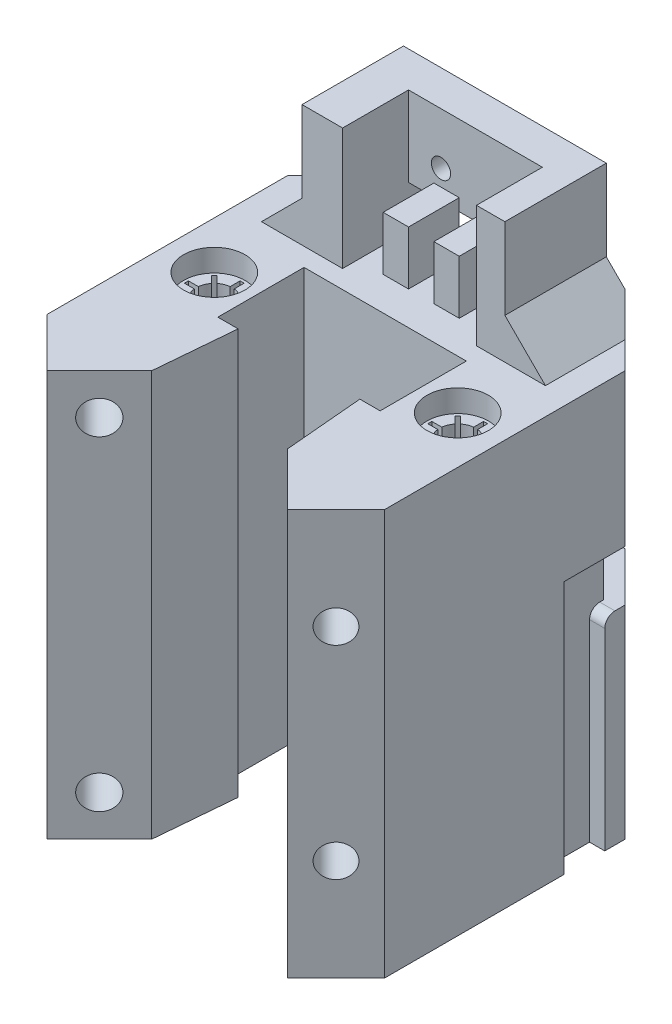
from build123d import *

# Parameters (mm, degrees)
EXTRUDE_1_DEPTH          = 40
SKETCH_2_R               = 1.7
CUT_EXTRUDE_1_DEPTH      = 47.415999397
CUT_EXTRUDE_2_DEPTH      = 47.415999397
EXTRUDE_2_DEPTH          = 12
SKETCH_5_W               = 12
SKETCH_5_H               = 8.5
CUT_EXTRUDE_3_DEPTH      = 47.415999397
CUT_EXTRUDE_4_DEPTH      = 12
SKETCH_7_W               = 2.5
SKETCH_7_H               = 5
EXTRUDE_3_DEPTH          = 5.3
SKETCH_8_W               = 2.5
SKETCH_8_H               = 5
EXTRUDE_4_DEPTH          = 5.2
SKETCH_10_W              = 16
SKETCH_10_H              = 8.5
CUT_EXTRUDE_5_DEPTH      = 47.415999397
SKETCH_11_W              = 7.5
SKETCH_11_H              = 4.1
CUT_EXTRUDE_6_DEPTH      = 11
SKETCH_15_W              = 7.5
SKETCH_15_H              = 5
CUT_EXTRUDE_10_DEPTH     = 10
SKETCH_12_W              = 7.5
SKETCH_12_H              = 1.5
CUT_EXTRUDE_7_DEPTH      = 28
CUT_EXTRUDE_START        = -20
CUT_EXTRUDE_8_DEPTH      = 5
FILLET_2_R               = 2
SKETCH_16_R              = 3.025
CUT_EXTRUDE_11_DEPTH     = 2.2
CUT_EXTRUDE_13_DEPTH     = 2.8
SKETCH_21_R              = 1.6
CUT_EXTRUDE_14_DEPTH     = 5
MIRROR_3_COPY_1_SKETCH_R = 1.6
MIRROR_3_COPY_1_DEPTH    = 5
SKETCH_17_W              = 1.5
SKETCH_17_H              = 4
CUT_EXTRUDE_12_DEPTH     = 40.729648878
FILLET_3_R               = 1
CHAMFER_2_SIZE           = 4
SKETCH_22_R              = 0.95
CUT_EXTRUDE_15_DEPTH     = 63.20339621
SKETCH_23_R              = 0.95
CUT_EXTRUDE_16_DEPTH     = 60.364235866
SKETCH_25_R              = 1.65
CUT_EXTRUDE_17_DEPTH     = 5


with BuildPart() as part:
    # 草图1 → 凸台-拉伸1 (new body)
    with BuildSketch(Plane(origin=(0, 0, 0), x_dir=(1, 0, 0), z_dir=(0, 1, 0))):
        Polygon((11.846403282, 16.65), (-11.846403282, 16.65), (-16.65, 11.846403282), (-16.65, -11.846403282), (-11.846403282, -16.65), (11.846403282, -16.65), (16.65, -11.846403282), (16.65, 11.846403282), align=None)
    extrude(amount=EXTRUDE_1_DEPTH)

    # 草图2 → 切除-拉伸1 (cut, through all)
    with BuildSketch(Plane(origin=(0, 40, 0), x_dir=(1, 0, 0), z_dir=(0, 1, 0))):
        with Locations(Location((12, 0, 0), (0, 0, 270))):
            Circle(SKETCH_2_R)
        with Locations(Location((-12, 0, 0), (0, 0, 90))):
            Circle(SKETCH_2_R)
    extrude(amount=-CUT_EXTRUDE_1_DEPTH, mode=Mode.SUBTRACT)

    # 草图3 → 切除-拉伸2 (cut, through all)
    with BuildSketch(Plane(origin=(0, 40, 0), x_dir=(1, 0, 0), z_dir=(0, 1, 0))):
        Polygon((-6, -3.65), (6, -3.65), (6.685863935, -11.489460654), (11.846403282, -16.65), (-11.846403282, -16.65), (-6.685863935, -11.489460654), align=None)
    extrude(amount=-CUT_EXTRUDE_2_DEPTH, mode=Mode.SUBTRACT)

    # 草图4 → 凸台-拉伸2 (add)
    with BuildSketch(Plane(origin=(0, 40, 0), x_dir=(1, 0, 0), z_dir=(0, 1, 0))):
        Polygon((-10, 16.65), (-10, 6.65), (-6, 6.65), (-6, 13.15), (7.2, 13.15), (7.2, 6.65), (10, 6.65), (10, 16.65), align=None)
    extrude(amount=EXTRUDE_2_DEPTH)

    # 草图5 → 切除-拉伸3 (cut, through all)
    with BuildSketch(Plane(origin=(0, 40, 0), x_dir=(1, 0, 0), z_dir=(0, 1, 0))):
        with Locations((0, 0.6)):
            Rectangle(SKETCH_5_W, SKETCH_5_H)
    extrude(amount=-CUT_EXTRUDE_3_DEPTH, mode=Mode.SUBTRACT)

    # 草图6 → 切除-拉伸4 (cut)
    with BuildSketch(Plane.XZ):
        Polygon((-6, -6.65), (-6, -13.15), (-6, -16.65), (7.2, -16.65), (7.2, -13.15), (7.2, -6.65), align=None)
    extrude(amount=-CUT_EXTRUDE_4_DEPTH, mode=Mode.SUBTRACT)

    # 草图7 → 凸台-拉伸3 (add)
    with BuildSketch(Plane(origin=(0, 40, 0), x_dir=(1, 0, 0), z_dir=(0, 1, 0))):
        with Locations((2.75, 10.65)):
            Rectangle(SKETCH_7_W, SKETCH_7_H)
        with Locations((-2.25, 10.65)):
            Rectangle(SKETCH_7_W, SKETCH_7_H)
    extrude(amount=EXTRUDE_3_DEPTH)

    # 草图8 → 凸台-拉伸4 (add)
    with BuildSketch(Plane.XZ.offset(-12)):
        with Locations((-2.25, -9.15)):
            Rectangle(SKETCH_8_W, SKETCH_8_H)
        with Locations((2.75, -9.15)):
            Rectangle(SKETCH_8_W, SKETCH_8_H)
    extrude(amount=EXTRUDE_4_DEPTH)

    # 草图10 → 切除-拉伸5 (cut, through all)
    with BuildSketch(Plane(origin=(0, 40, 0), x_dir=(1, 0, 0), z_dir=(0, 1, 0))):
        with Locations((0, 0.6)):
            Rectangle(SKETCH_10_W, SKETCH_10_H)
    extrude(amount=-CUT_EXTRUDE_5_DEPTH, mode=Mode.SUBTRACT)

    # 草图11 → 切除-拉伸6 (cut)
    with BuildSketch(Plane.XY.offset(-13.15)):
        with Locations((-2.25, 42.05)):
            Rectangle(SKETCH_11_W, SKETCH_11_H)
    extrude(amount=-CUT_EXTRUDE_6_DEPTH, mode=Mode.SUBTRACT)

    # 草图15 → 切除-拉伸10 (cut)
    with BuildSketch(Plane(origin=(0, 0, -16.65), x_dir=(-1, 0, 0), z_dir=(0, 0, -1))):
        with Locations((2.25, 14.5)):
            Rectangle(SKETCH_15_W, SKETCH_15_H)
    extrude(amount=-CUT_EXTRUDE_10_DEPTH, mode=Mode.SUBTRACT)

    # 草图12 → 切除-拉伸7 (cut)
    with BuildSketch(Plane(origin=(0, 40, 0), x_dir=(1, 0, 0), z_dir=(0, 1, 0))):
        with Locations((-2.25, 15.9)):
            Rectangle(SKETCH_12_W, SKETCH_12_H)
    extrude(amount=-CUT_EXTRUDE_7_DEPTH, mode=Mode.SUBTRACT)

    # 草图13 → 切除-拉伸8 (cut)
    with BuildSketch(Plane.XZ.offset(CUT_EXTRUDE_START)):
        Polygon((11.846403282, -16.65), (1.5, -16.65), (1.5, -15.15), (11.225082938, -15.15), (15.15, -11.225082938), (15.15, -5.846403282), (16.65, -5.846403282), (16.65, -11.846403282), align=None)
    extrude(amount=-CUT_EXTRUDE_8_DEPTH, mode=Mode.SUBTRACT)

    # 圆角2
    fillet_2_edges = [part.edges().sort_by_distance(p)[0] for p in [
        (-2.25, 17, -15.15),
    ]]
    fillet(fillet_2_edges, radius=FILLET_2_R)

    # 草图16 → 切除-拉伸11 (cut)
    with BuildSketch(Plane(origin=(0, 40, 0), x_dir=(1, 0, 0), z_dir=(0, 1, 0))):
        with Locations(Location((12, 0, 0), (0, 0, 270))):
            Circle(SKETCH_16_R)
        with Locations(Location((-12, 0, 0), (0, 0, 270))):
            Circle(SKETCH_16_R)
    cut_extrude_11 = extrude(amount=-CUT_EXTRUDE_11_DEPTH, mode=Mode.SUBTRACT)

    # 草图19 → 切除-拉伸13 (cut)
    with BuildSketch(Plane(origin=(0, 37.8, 0), x_dir=(1, 0, 0), z_dir=(0, 1, 0))):
        with BuildLine():
            Line((-10.196877708, 2.085965005), (-10.890741541, 1.392101171))
            ThreePointArc((-10.890741541, 1.392101171), (-11.31882349, 1.644505568), (-11.8, 1.768728357))
            Line((-11.8, 1.768728357), (-11.8, 2.75))
            Line((-11.8, 2.75), (-12.2, 2.75))
            Line((-12.2, 2.75), (-12.2, 1.768728357))
            ThreePointArc((-12.2, 1.768728357), (-12.68117651, 1.644505568), (-13.109258459, 1.392101171))
            Line((-13.109258459, 1.392101171), (-13.803122292, 2.085965005))
            Line((-13.803122292, 2.085965005), (-14.085965005, 1.803122292))
            Line((-14.085965005, 1.803122292), (-13.392101171, 1.109258459))
            ThreePointArc((-13.392101171, 1.109258459), (-13.644505568, 0.68117651), (-13.768728357, 0.2))
            Line((-13.768728357, 0.2), (-14.75, 0.2))
            Line((-14.75, 0.2), (-14.75, -0.2))
            Line((-14.75, -0.2), (-13.768728357, -0.2))
            ThreePointArc((-13.768728357, -0.2), (-13.644505568, -0.68117651), (-13.392101171, -1.109258459))
            Line((-13.392101171, -1.109258459), (-14.085965005, -1.803122292))
            Line((-14.085965005, -1.803122292), (-13.803122292, -2.085965005))
            Line((-13.803122292, -2.085965005), (-13.109258459, -1.392101171))
            ThreePointArc((-13.109258459, -1.392101171), (-12.68117651, -1.644505568), (-12.2, -1.768728357))
            Line((-12.2, -1.768728357), (-12.2, -2.75))
            Line((-12.2, -2.75), (-11.8, -2.75))
            Line((-11.8, -2.75), (-11.8, -1.768728357))
            ThreePointArc((-11.8, -1.768728357), (-11.31882349, -1.644505568), (-10.890741541, -1.392101171))
            Line((-10.890741541, -1.392101171), (-10.196877708, -2.085965005))
            Line((-10.196877708, -2.085965005), (-9.914034995, -1.803122292))
            Line((-9.914034995, -1.803122292), (-10.607898829, -1.109258459))
            ThreePointArc((-10.607898829, -1.109258459), (-10.355494432, -0.68117651), (-10.231271643, -0.2))
            Line((-10.231271643, -0.2), (-9.25, -0.2))
            Line((-9.25, -0.2), (-9.25, 0.2))
            Line((-9.25, 0.2), (-10.231271643, 0.2))
            ThreePointArc((-10.231271643, 0.2), (-10.355494432, 0.68117651), (-10.607898829, 1.109258459))
            Line((-10.607898829, 1.109258459), (-9.914034995, 1.803122292))
            Line((-9.914034995, 1.803122292), (-10.196877708, 2.085965005))
        make_face()
        with BuildLine():
            Line((13.803122292, 2.085965005), (13.109258459, 1.392101171))
            ThreePointArc((13.109258459, 1.392101171), (12.68117651, 1.644505568), (12.2, 1.768728357))
            Line((12.2, 1.768728357), (12.2, 2.75))
            Line((12.2, 2.75), (11.8, 2.75))
            Line((11.8, 2.75), (11.8, 1.768728357))
            ThreePointArc((11.8, 1.768728357), (11.31882349, 1.644505568), (10.890741541, 1.392101171))
            Line((10.890741541, 1.392101171), (10.196877708, 2.085965005))
            Line((10.196877708, 2.085965005), (9.914034995, 1.803122292))
            Line((9.914034995, 1.803122292), (10.607898829, 1.109258459))
            ThreePointArc((10.607898829, 1.109258459), (10.355494432, 0.68117651), (10.231271643, 0.2))
            Line((10.231271643, 0.2), (9.25, 0.2))
            Line((9.25, 0.2), (9.25, -0.2))
            Line((9.25, -0.2), (10.231271643, -0.2))
            ThreePointArc((10.231271643, -0.2), (10.355494432, -0.68117651), (10.607898829, -1.109258459))
            Line((10.607898829, -1.109258459), (9.914034995, -1.803122292))
            Line((9.914034995, -1.803122292), (10.196877708, -2.085965005))
            Line((10.196877708, -2.085965005), (10.890741541, -1.392101171))
            ThreePointArc((10.890741541, -1.392101171), (11.31882349, -1.644505568), (11.8, -1.768728357))
            Line((11.8, -1.768728357), (11.8, -2.75))
            Line((11.8, -2.75), (12.2, -2.75))
            Line((12.2, -2.75), (12.2, -1.768728357))
            ThreePointArc((12.2, -1.768728357), (12.68117651, -1.644505568), (13.109258459, -1.392101171))
            Line((13.109258459, -1.392101171), (13.803122292, -2.085965005))
            Line((13.803122292, -2.085965005), (14.085965005, -1.803122292))
            Line((14.085965005, -1.803122292), (13.392101171, -1.109258459))
            ThreePointArc((13.392101171, -1.109258459), (13.644505568, -0.68117651), (13.768728357, -0.2))
            Line((13.768728357, -0.2), (14.75, -0.2))
            Line((14.75, -0.2), (14.75, 0.2))
            Line((14.75, 0.2), (13.768728357, 0.2))
            ThreePointArc((13.768728357, 0.2), (13.644505568, 0.68117651), (13.392101171, 1.109258459))
            Line((13.392101171, 1.109258459), (14.085965005, 1.803122292))
            Line((14.085965005, 1.803122292), (13.803122292, 2.085965005))
        make_face()
    cut_extrude_13 = extrude(amount=-CUT_EXTRUDE_13_DEPTH, mode=Mode.SUBTRACT)

    # 镜向1: 切除-拉伸11, 切除-拉伸13 across plane
    add(cut_extrude_11.mirror(Plane.ZX.offset(20)), mode=Mode.SUBTRACT)
    add(cut_extrude_13.mirror(Plane.ZX.offset(20)), mode=Mode.SUBTRACT)

    # 草图21 → 切除-拉伸14 (cut)
    with BuildSketch(Plane(origin=(-14.248201641, 0, 14.248201641), x_dir=(0.7071067811865477, 0, 0.7071067811865474), z_dir=(-0.7071067811865474, 0, 0.7071067811865477))):
        with Locations((0, 30)):
            Circle(SKETCH_21_R)
        with Locations(Location((0, 10, 0), (0, 0, 180))):
            Circle(SKETCH_21_R)
    cut_extrude_14 = extrude(amount=-CUT_EXTRUDE_14_DEPTH, mode=Mode.SUBTRACT)

    # 镜向2: 切除-拉伸14 across plane
    add(cut_extrude_14.mirror(Plane(origin=(0, 0, 0), x_dir=(0, 0, 1), z_dir=(1, 0, 0))), mode=Mode.SUBTRACT)

    # 镜向3: 切除-拉伸14 across plane
    add(cut_extrude_14.mirror(Plane.XY), mode=Mode.SUBTRACT)

    # 镜向3 copy 1 sketch → 镜向3 copy 1 (cut)
    with BuildSketch(Plane(origin=(14.248201641, 0, -14.248201641), x_dir=(-0.7071067811865477, 0, -0.7071067811865474), z_dir=(0.7071067811865474, 0, -0.7071067811865477))):
        with Locations((0, 30)):
            Circle(MIRROR_3_COPY_1_SKETCH_R)
        with Locations(Location((0, 10, 0), (0, 0, 180))):
            Circle(MIRROR_3_COPY_1_SKETCH_R)
    extrude(amount=-MIRROR_3_COPY_1_DEPTH, mode=Mode.SUBTRACT)

    # 草图17 → 切除-拉伸12 (cut, through all)
    with BuildSketch(Plane(origin=(0, 20, 0), x_dir=(1, 0, 0), z_dir=(0, 1, 0))):
        with Locations((15.9, 7.846403282)):
            Rectangle(SKETCH_17_W, SKETCH_17_H)
    extrude(amount=-CUT_EXTRUDE_12_DEPTH, mode=Mode.SUBTRACT)

    # 圆角3
    fillet_3_edges = [part.edges().sort_by_distance(p)[0] for p in [
        (1.5, 25, -15.9),
        (1.5, 20, -15.9),
        (15.9, 20, -9.846403282),
    ]]
    fillet(fillet_3_edges, radius=FILLET_3_R)

    # 倒角2
    chamfer_2_edges = [part.edges().sort_by_distance(p)[0] for p in [
        (10, 40, -11.65),
        (-10, 40, -11.65),
    ]]
    chamfer(chamfer_2_edges, length=CHAMFER_2_SIZE)

    # 草图22 → 切除-拉伸15 (cut, through all)
    with BuildSketch(Plane.XY.offset(-13.15)):
        with Locations((-2.8, 46.9)):
            Circle(SKETCH_22_R)
        with Locations((3.7, 46.9)):
            Circle(SKETCH_22_R)
    extrude(amount=-CUT_EXTRUDE_15_DEPTH, mode=Mode.SUBTRACT)

    # 草图23 → 切除-拉伸16 (cut, through all)
    with BuildSketch(Plane(origin=(0, 0, -6.65), x_dir=(-1, 0, 0), z_dir=(0, 0, -1))):
        with Locations((2.8, 5.1)):
            Circle(SKETCH_23_R)
        with Locations((-3.7, 5.1)):
            Circle(SKETCH_23_R)
    extrude(amount=-CUT_EXTRUDE_16_DEPTH, mode=Mode.SUBTRACT)

    # 草图25 → 切除-拉伸17 (cut)
    with BuildSketch(Plane(origin=(2.401798359, 0, 2.401798359), x_dir=(0.7071067811865468, 0, -0.7071067811865483), z_dir=(0.7071067811865483, 0, 0.7071067811865468))):
        with Locations((-16.500947634, 36)):
            Circle(SKETCH_25_R)
        with Locations(Location((-16.500947634, 4, 0), (0, 0, 180))):
            Circle(SKETCH_25_R)
    cut_extrude_17 = extrude(amount=-CUT_EXTRUDE_17_DEPTH, mode=Mode.SUBTRACT)

    # 镜向4: 切除-拉伸17 across plane
    add(cut_extrude_17.mirror(Plane(origin=(0, 0, 0), x_dir=(0, 0, 1), z_dir=(1, 0, 0))), mode=Mode.SUBTRACT)


solid = part.part
